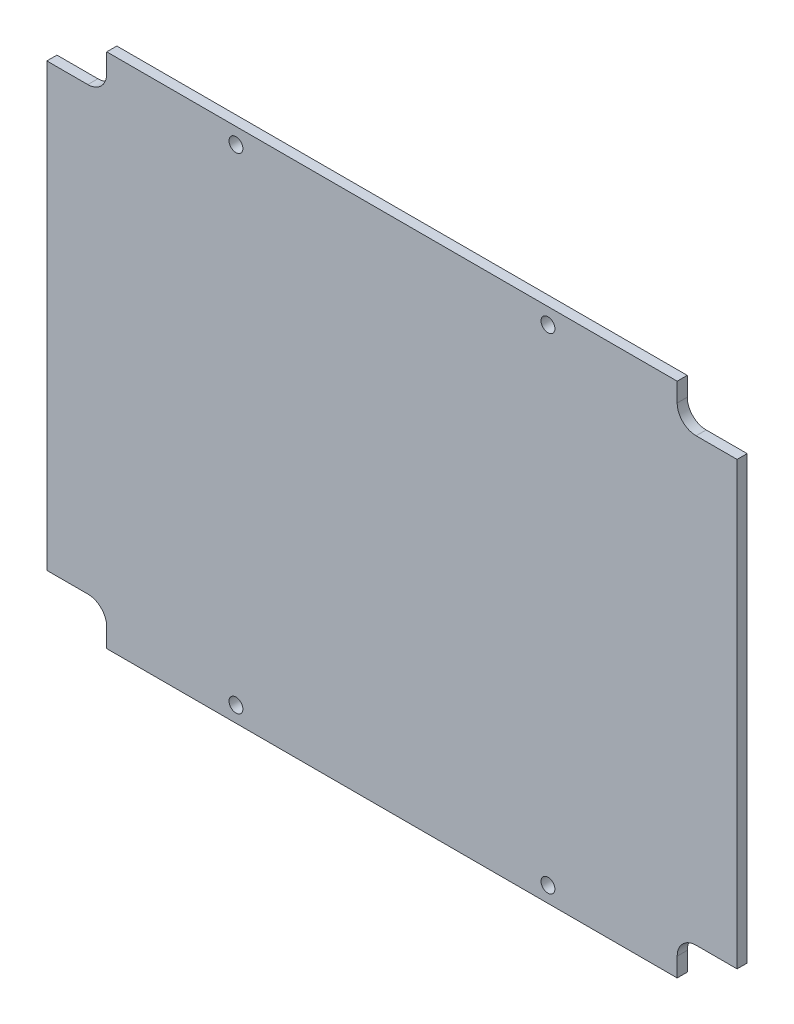
from build123d import *

# Parameters (mm, degrees)
SKETCH1_R           = 1.1
BOSS_EXTRUDE1_DEPTH = 1.6
FILLET1_R           = 3


with BuildPart() as part:
    # Sketch1 → Boss-Extrude1 (new body)
    with BuildSketch(Plane.XY):
        Polygon((-55.493641502, 9.95185693), (-45.993641502, 9.95185693), (-45.993641502, 3.95185693), (44.506358498, 3.95185693), (44.506358498, 9.95185693), (54.006358498, 9.95185693), (54.006358498, 79.95185693), (44.506358498, 79.95185693), (44.506358498, 85.95185693), (-45.993641502, 85.95185693), (-45.993641502, 79.95185693), (-55.493641502, 79.95185693), align=None)
        with Locations((-25.493641502, 83.45185693)):
            Circle(SKETCH1_R, mode=Mode.SUBTRACT)
        with Locations((24.006358498, 83.45185693)):
            Circle(SKETCH1_R, mode=Mode.SUBTRACT)
        with Locations((24.006358498, 6.45185693)):
            Circle(SKETCH1_R, mode=Mode.SUBTRACT)
        with Locations((-25.493641502, 6.45185693)):
            Circle(SKETCH1_R, mode=Mode.SUBTRACT)
    extrude(amount=BOSS_EXTRUDE1_DEPTH)

    # Fillet1
    fillet1_edges = [part.edges().sort_by_distance(p)[0] for p in [
        (-45.993641502, 79.95185693, 0.8),
        (44.506358498, 79.95185693, 0.8),
        (44.506358498, 9.95185693, 0.8),
        (-45.993641502, 9.95185693, 0.8),
    ]]
    fillet(fillet1_edges, radius=FILLET1_R)


solid = part.part
